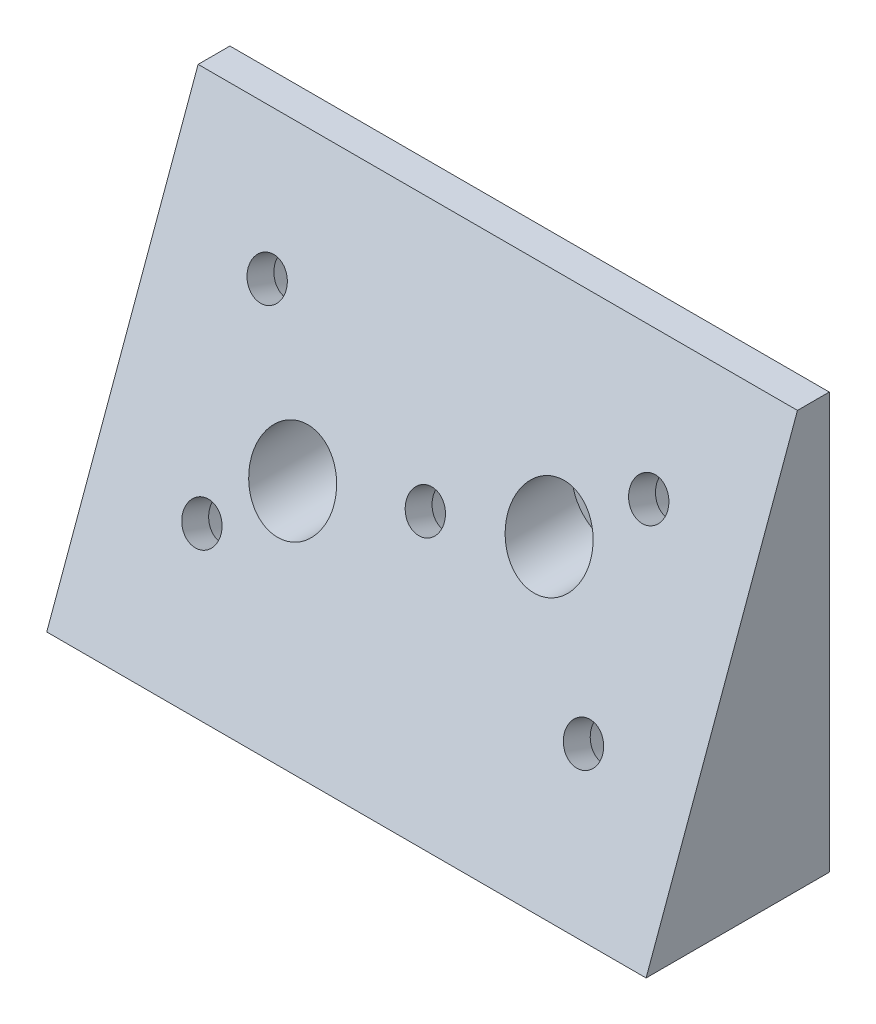
from build123d import *

# Parameters (mm, degrees)
SKETCH1_W           = 94.24092637
SKETCH1_H           = 65.39427142
BOSS_EXTRUDE1_DEPTH = 5
BOSS_EXTRUDE2_DEPTH = 94.24092637
SKETCH4_R           = 4.5
CUT_EXTRUDE1_DEPTH  = 94.24092637
CUT_EXTRUDE2_START  = -4.69
SKETCH4_4_R         = 6.5
CUT_EXTRUDE2_DEPTH  = 94.24092637
SKETCH3_R           = 3
CUT_EXTRUDE3_DEPTH  = 94.24092637
CUT_EXTRUDE4_START  = -4.5
SKETCH3_3_R         = 4.75
CUT_EXTRUDE4_DEPTH  = 94.24092637


with BuildPart() as part:
    # Sketch1 → Boss-Extrude1 (new body)
    with BuildSketch(Plane.XY):
        with Locations((47.120463185, -32.69713571)):
            Rectangle(SKETCH1_W, SKETCH1_H)
    extrude(amount=BOSS_EXTRUDE1_DEPTH)

    # Sketch2 → Boss-Extrude2 (add)
    with BuildSketch(Plane(origin=(94.24092637, 0, 0), x_dir=(0, 0, -1), z_dir=(1, 0, 0))):
        Polygon((-5, -65.39427142), (-28.80156829, -65.39427142), (-5, 0), align=None)
    extrude(amount=-BOSS_EXTRUDE2_DEPTH)

    # Sketch4 → Cut-Extrude1 (cut)
    with BuildSketch(Plane(origin=(0, 0, 0), x_dir=(-1, 0, 0), z_dir=(0, 0, -1))):
        with Locations((-64.990115154, -26.926235979)):
            Circle(SKETCH4_R)
        with Locations((-28.021847985, -36.1434602)):
            Circle(SKETCH4_R)
    extrude(amount=-CUT_EXTRUDE1_DEPTH, mode=Mode.SUBTRACT)

    # Sketch4<4> → Cut-Extrude2 (cut)
    with BuildSketch(Plane(origin=(0, 0, 0), x_dir=(-1, 0, 0), z_dir=(0, 0, -1)).offset(CUT_EXTRUDE2_START)):
        with Locations((-64.990115154, -26.926235979)):
            Circle(SKETCH4_4_R)
        with Locations((-28.021847985, -36.1434602)):
            Circle(SKETCH4_4_R)
    extrude(amount=-CUT_EXTRUDE2_DEPTH, mode=Mode.SUBTRACT)

    # Sketch3 → Cut-Extrude3 (cut)
    with BuildSketch(Plane(origin=(0, 1.606969024, 4.415111108), x_dir=(1, 0, 0), z_dir=(0, 0.34202014334590697, 0.9396926207785422))):
        with Locations((47.20092637, -35.257197457)):
            Circle(SKETCH3_R)
        with Locations((17.20092637, -50.257197457)):
            Circle(SKETCH3_R)
        with Locations((17.20092637, -20.257197457)):
            Circle(SKETCH3_R)
        with Locations((77.20092637, -20.257197457)):
            Circle(SKETCH3_R)
        with Locations((77.20092637, -50.257197457)):
            Circle(SKETCH3_R)
    extrude(amount=-CUT_EXTRUDE3_DEPTH, mode=Mode.SUBTRACT)

    # Sketch3<3> → Cut-Extrude4 (cut)
    with BuildSketch(Plane(origin=(0, 1.606969024, 4.415111108), x_dir=(1, 0, 0), z_dir=(0, 0.34202014334590697, 0.9396926207785422)).offset(CUT_EXTRUDE4_START)):
        with Locations((17.20092637, -20.257197457)):
            Circle(SKETCH3_3_R)
        with Locations((17.20092637, -50.257197457)):
            Circle(SKETCH3_3_R)
        with Locations((47.20092637, -35.257197457)):
            Circle(SKETCH3_3_R)
        with Locations((77.20092637, -20.257197457)):
            Circle(SKETCH3_3_R)
        with Locations((77.20092637, -50.257197457)):
            Circle(SKETCH3_3_R)
    extrude(amount=-CUT_EXTRUDE4_DEPTH, mode=Mode.SUBTRACT)


solid = part.part
